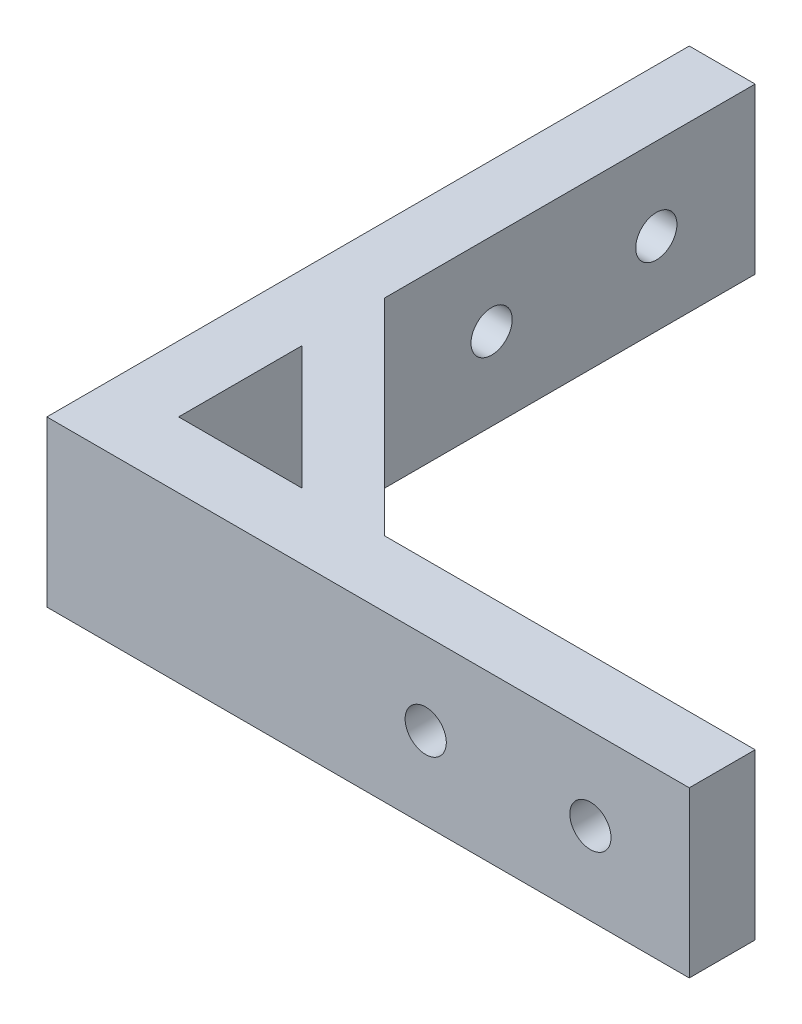
from build123d import *

# Parameters (mm, degrees)
BOSS_EXTRUDE1_DEPTH = 10
BOSS_EXTRUDE2_DEPTH = 10
SKETCH2_R           = 2.5
CUT_EXTRUDE1_DEPTH  = 8
SKETCH3_R           = 2.5
CUT_EXTRUDE2_DEPTH  = 8


with BuildPart() as part:
    # Sketch1 → Boss-Extrude1 (new, symmetric)
    with BuildSketch(Plane(origin=(0, 0, 0), x_dir=(1, 0, 0), z_dir=(0, 1, 0))):
        Polygon((8, 8), (8, 23), (8, 33), (8, 78), (0, 78), (0, 0), (78, 0), (78, 8), (33, 8), (23, 8), align=None)
    extrude(amount=BOSS_EXTRUDE1_DEPTH, both=True)

    # Sketch1<3> → Boss-Extrude2 (add, symmetric)
    with BuildSketch(Plane(origin=(0, 0, 0), x_dir=(1, 0, 0), z_dir=(0, 1, 0))):
        Polygon((8, 33), (8, 23), (23, 8), (33, 8), align=None)
    extrude(amount=BOSS_EXTRUDE2_DEPTH, both=True)

    # Sketch2 → Cut-Extrude1 (cut)
    with BuildSketch(Plane(origin=(8, 0, 0), x_dir=(0, 0, -1), z_dir=(1, 0, 0))):
        with Locations((46, 0)):
            Circle(SKETCH2_R)
        with Locations((66, 0)):
            Circle(SKETCH2_R)
    extrude(amount=-CUT_EXTRUDE1_DEPTH, mode=Mode.SUBTRACT)

    # Sketch3 → Cut-Extrude2 (cut)
    with BuildSketch(Plane(origin=(0, 0, -8), x_dir=(-1, 0, 0), z_dir=(0, 0, -1))):
        with Locations((-66, 0)):
            Circle(SKETCH3_R)
        with Locations((-46, 0)):
            Circle(SKETCH3_R)
    extrude(amount=-CUT_EXTRUDE2_DEPTH, mode=Mode.SUBTRACT)


solid = part.part
